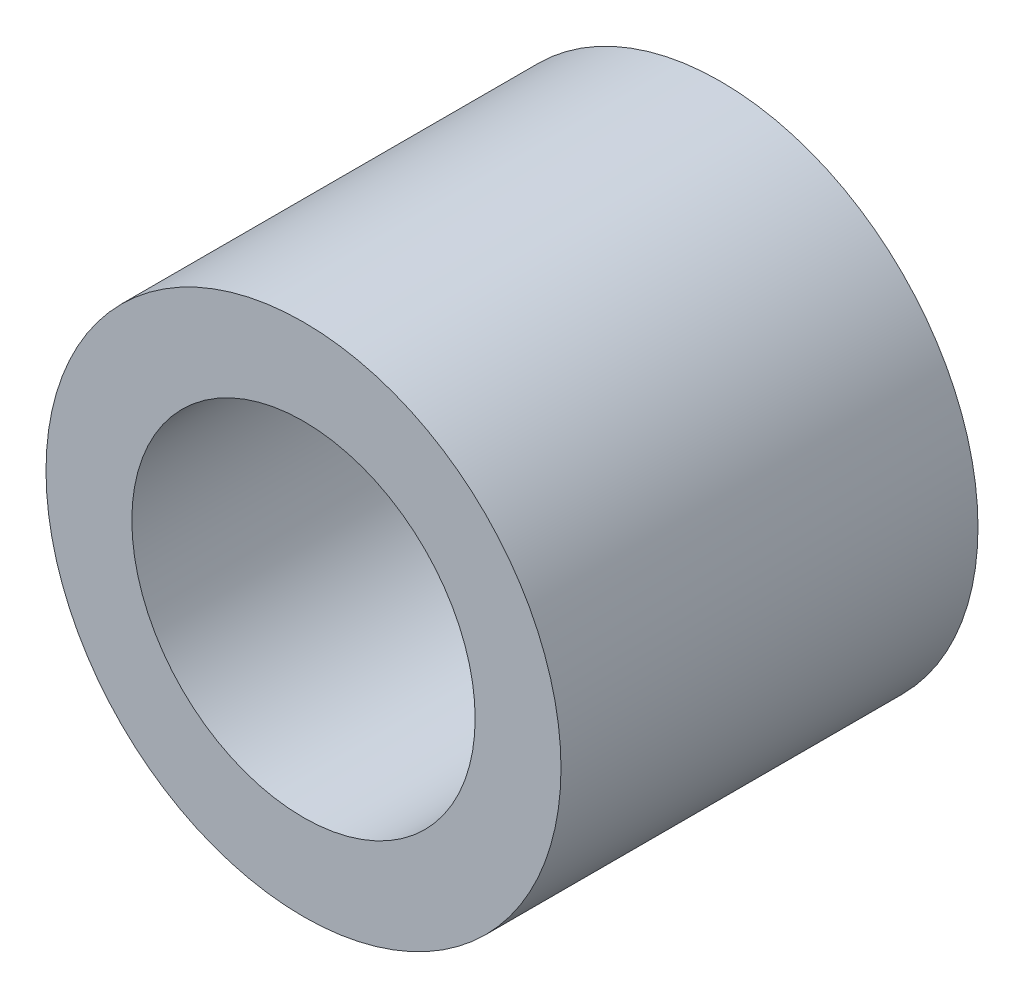
from build123d import *

# Parameters (mm, degrees)
SKETCH1_R           = 9.525
SKETCH1_R_2         = 6.35
BOSS_EXTRUDE1_DEPTH = 7.71271


with BuildPart() as part:
    # Sketch1 → Boss-Extrude1 (new, symmetric)
    with BuildSketch(Plane.XY):
        Circle(SKETCH1_R)
        Circle(SKETCH1_R_2, mode=Mode.SUBTRACT)
    extrude(amount=BOSS_EXTRUDE1_DEPTH, both=True)


solid = part.part
